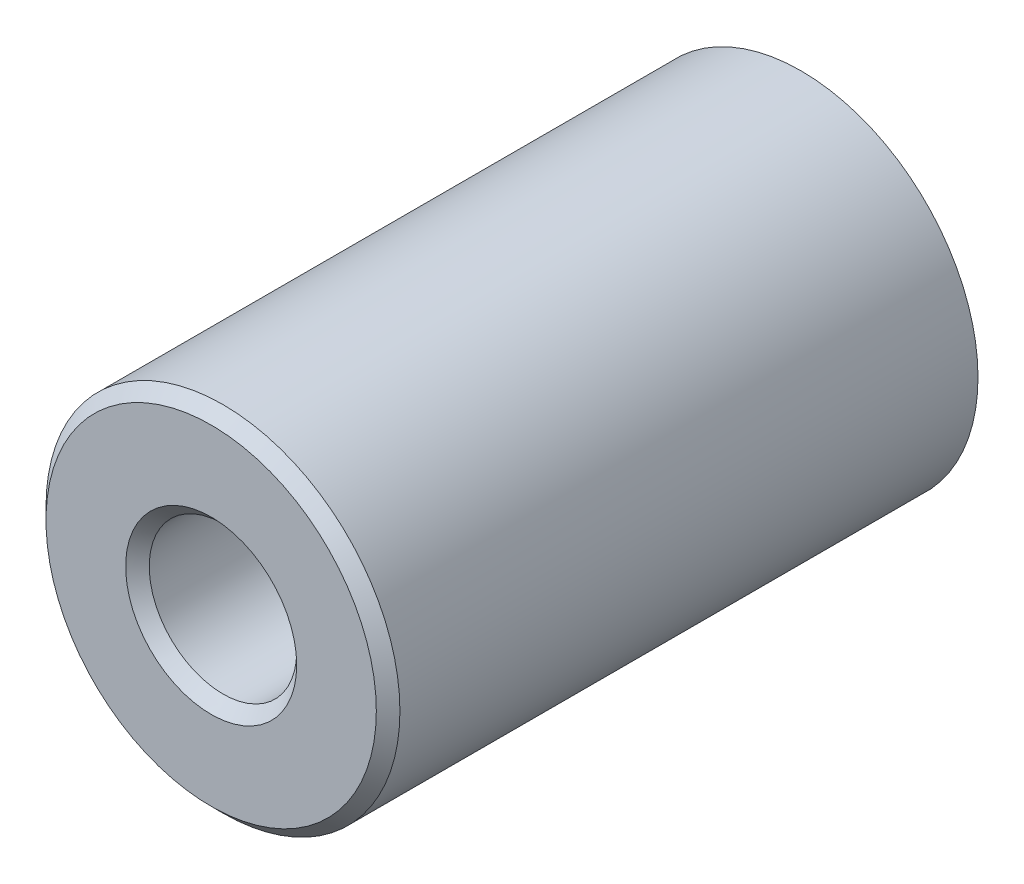
from build123d import *

# Parameters (mm, degrees)
SKETCH_1_R         = 3
EXTRUDE_1_DEPTH    = 10
HOLE_WIZARD_M3_1_D = 2.5
CHAMFER_1_SIZE     = 0.2


with BuildPart() as part:
    # 草图1 → 凸台-拉伸1 (new body)
    with BuildSketch(Plane.XY):
        Circle(SKETCH_1_R)
    extrude(amount=EXTRUDE_1_DEPTH)

    # M3 螺纹孔1 (through all)
    with Locations(Plane.XY.offset(10)):
        with Locations((0, 0)):
            Hole(HOLE_WIZARD_M3_1_D / 2)

    # 倒角1
    chamfer_1_edges = [part.edges().sort_by_distance(p)[0] for p in [
        (-3, 0, 10),
        (1.25, 0, 10),
        (1.25, 0, 0),
    ]]
    chamfer(chamfer_1_edges, length=CHAMFER_1_SIZE)


solid = part.part
